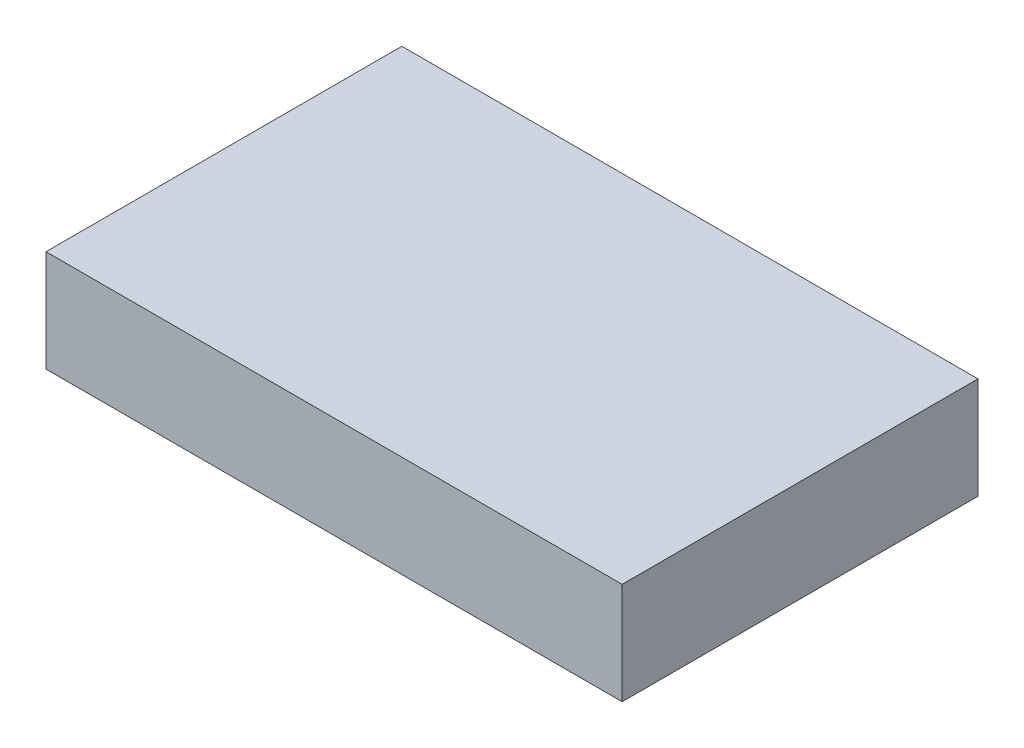
from build123d import *

# Parameters (mm, degrees)
SKETCH2_W           = 34
SKETCH2_H           = 21
BOSS_EXTRUDE1_DEPTH = 6


with BuildPart() as part:
    # Sketch2 → Boss-Extrude1 (new body)
    with BuildSketch(Plane(origin=(0, 0, 0), x_dir=(1, 0, 0), z_dir=(0, 1, 0))):
        Rectangle(SKETCH2_W, SKETCH2_H)
    extrude(amount=BOSS_EXTRUDE1_DEPTH)


solid = part.part
